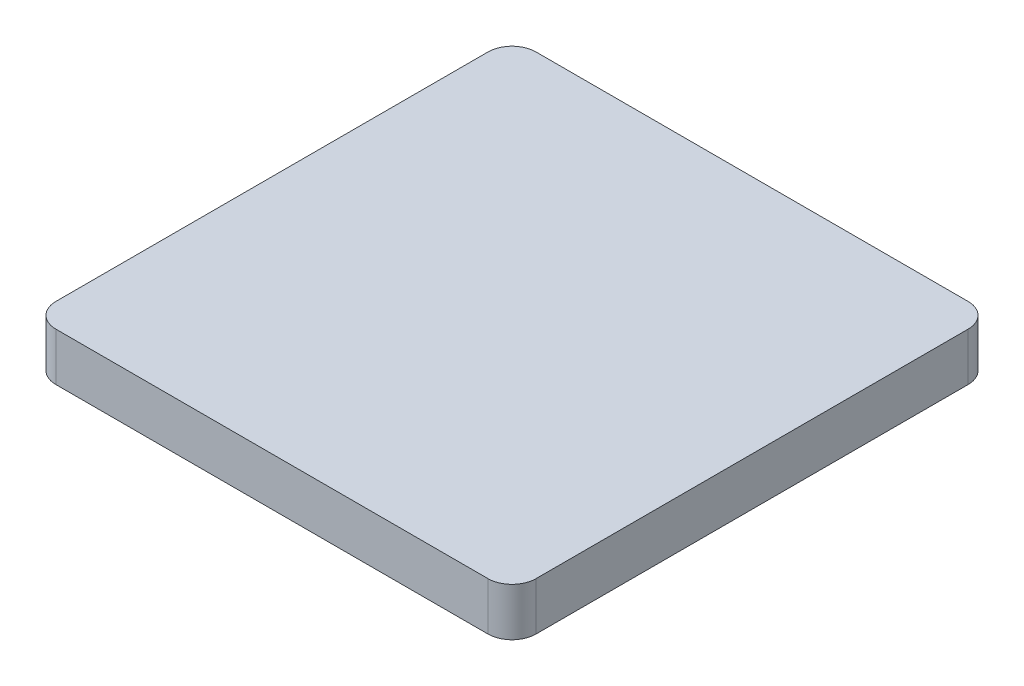
from build123d import *

# Parameters (mm, degrees)
BOSS_EXTRUDE1_DEPTH = 6.35


with BuildPart() as part:
    # Sketch1 → Boss-Extrude1 (new body)
    with BuildSketch(Plane(origin=(0, 0, 0), x_dir=(1, 0, 0), z_dir=(0, 1, 0))):
        with BuildLine():
            Line((-28.575, -31.75), (28.575, -31.75))
            ThreePointArc((28.575, -31.75), (30.82006403, -30.82006403), (31.75, -28.575))
            Line((31.75, -28.575), (31.75, 28.575))
            ThreePointArc((31.75, 28.575), (30.82006403, 30.82006403), (28.575, 31.75))
            Line((28.575, 31.75), (-28.575, 31.75))
            ThreePointArc((-28.575, 31.75), (-30.82006403, 30.82006403), (-31.75, 28.575))
            Line((-31.75, 28.575), (-31.75, -28.575))
            ThreePointArc((-31.75, -28.575), (-30.82006403, -30.82006403), (-28.575, -31.75))
        make_face()
    extrude(amount=BOSS_EXTRUDE1_DEPTH)


solid = part.part
